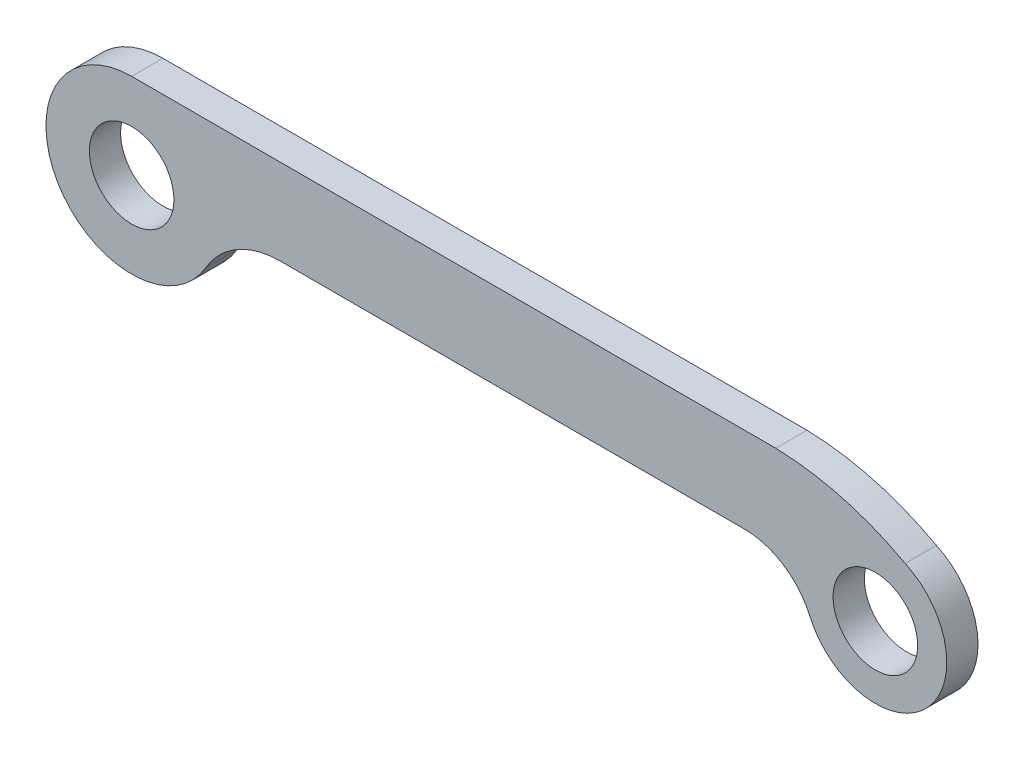
from build123d import *

# Parameters (mm, degrees)
SKETCH2_R           = 19.2
SKETCH2_R_2         = 9.472
SKETCH2_R_3         = 16
BOSS_EXTRUDE1_DEPTH = 7


with BuildPart() as part:
    # Sketch2 → Boss-Extrude1 (new body)
    # profile 1 of 3: a face of its own
    with BuildSketch(Plane.XY):
        with BuildLine():
            Line((144.339154619, 19.2), (0, 19.2))
            ThreePointArc((0, 19.2), (13.576450199, 13.576450199), (19.2, 0))
            ThreePointArc((19.2, 0), (18.545775865, -4.969325666), (16.627687753, -9.6))
            ThreePointArc((16.627687753, -9.6), (23.655375505, -2.572312247), (33.255375505, 0))
            Line((33.255375505, 0), (137.316262944, 0))
            ThreePointArc((137.316262944, 0), (146.079689306, -2.613351487), (151.980376503, -9.5997052))
            ThreePointArc((151.980376503, -9.5997052), (155.441326908, 8.223773716), (173.328738352, 11.337467698))
            ThreePointArc((173.328738352, 11.337467698), (159.301290335, 16.991856013), (144.339154619, 19.2))
        make_face()
    # profile 2 of 3: a face of its own
    with BuildSketch(Plane.XY):
        Circle(SKETCH2_R)
        Circle(SKETCH2_R_2, mode=Mode.SUBTRACT)
    # profile 3 of 3: a face of its own
    with BuildSketch(Plane.XY):
        with Locations((166.644490062, -3.199410399)):
            Circle(SKETCH2_R_3)
        with Locations((166.644490062, -3.199410399)):
            Circle(SKETCH2_R_2, mode=Mode.SUBTRACT)
    extrude(amount=BOSS_EXTRUDE1_DEPTH)


solid = part.part
